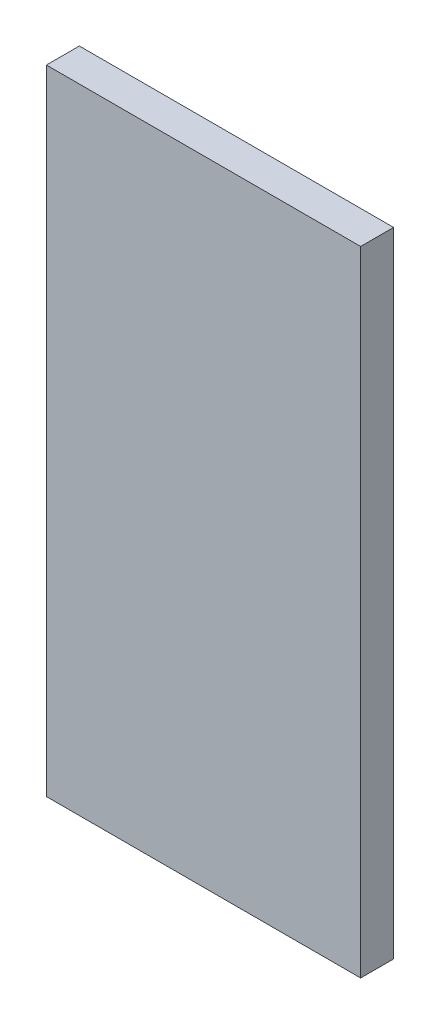
from build123d import *

# Parameters (mm, degrees)
SCHIZZO1_W                   = 62
SCHIZZO1_H                   = 125
ESTRUSIONE_ESTRUSIONE1_DEPTH = 6.5


with BuildPart() as part:
    # Schizzo1 → Estrusione-Estrusione1 (new body)
    with BuildSketch(Plane.XY):
        Rectangle(SCHIZZO1_W, SCHIZZO1_H)
    extrude(amount=ESTRUSIONE_ESTRUSIONE1_DEPTH)


solid = part.part
